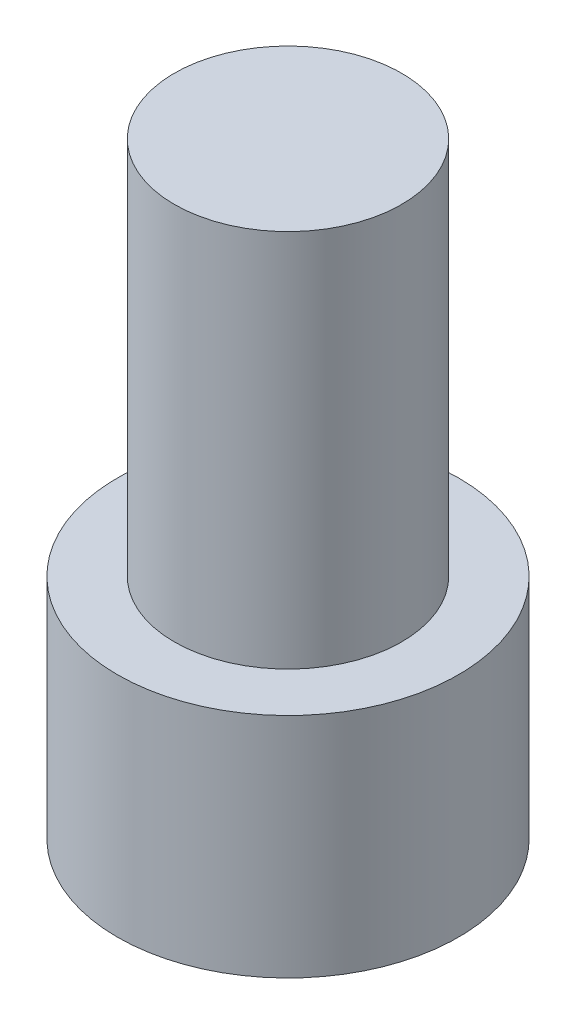
from build123d import *

# Parameters (mm, degrees)
SKETCH1_R           = 9
BOSS_EXTRUDE1_DEPTH = 12
SKETCH1_3_R         = 6
BOSS_EXTRUDE2_DEPTH = 32
CUT_EXTRUDE1_DEPTH  = 6


with BuildPart() as part:
    # Sketch1 → Boss-Extrude1 (new body)
    with BuildSketch(Plane(origin=(0, 0, 0), x_dir=(1, 0, 0), z_dir=(0, 1, 0))):
        Circle(SKETCH1_R)
    extrude(amount=BOSS_EXTRUDE1_DEPTH)

    # Sketch1<3> → Boss-Extrude2 (add)
    with BuildSketch(Plane(origin=(0, 0, 0), x_dir=(1, 0, 0), z_dir=(0, 1, 0))):
        Circle(SKETCH1_3_R)
    extrude(amount=BOSS_EXTRUDE2_DEPTH)

    # Sketch2 → Cut-Extrude1 (cut)
    with BuildSketch(Plane.XZ):
        Polygon((-3.5, -6.062177826), (3.5, -6.062177826), (7, 0), (3.5, 6.062177826), (-3.5, 6.062177826), (-7, 0), align=None)
    extrude(amount=-CUT_EXTRUDE1_DEPTH, mode=Mode.SUBTRACT)


solid = part.part
